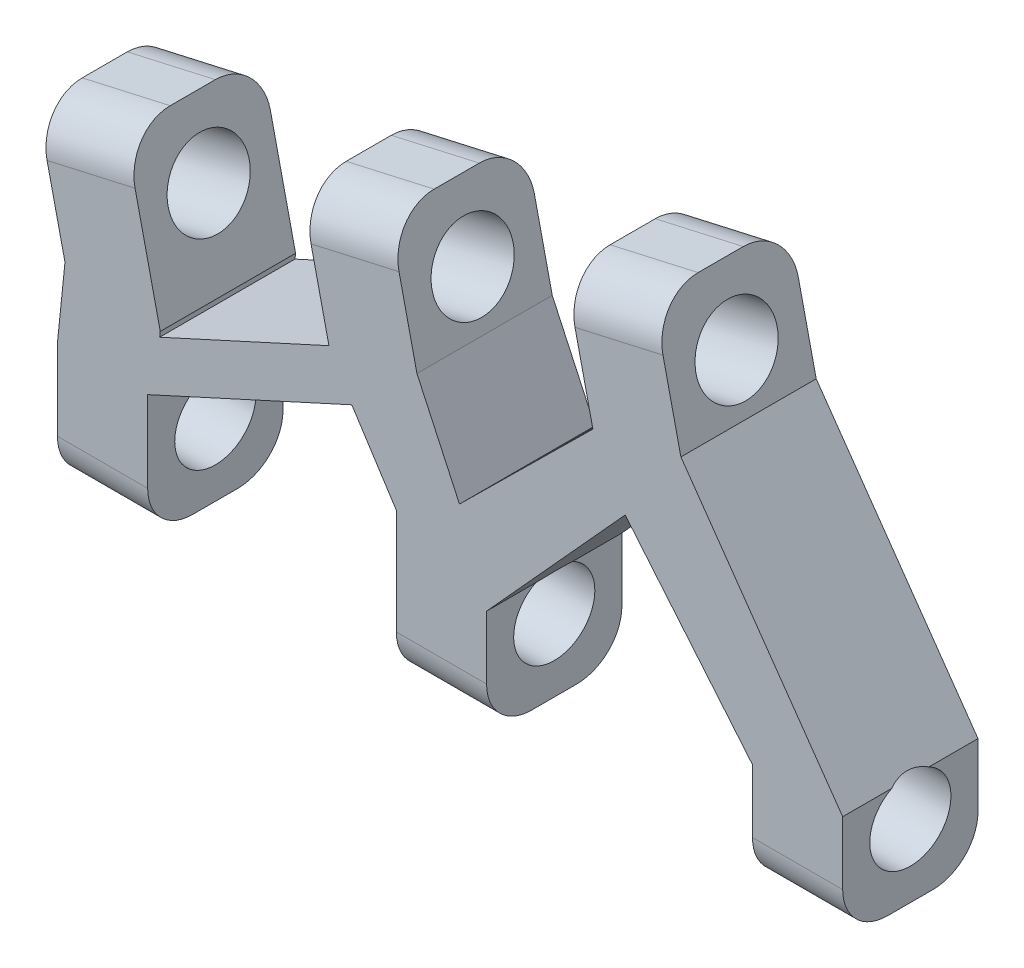
from build123d import *

# Parameters (mm, degrees)
BOSS_EXTRUDE1_DEPTH = 15
SKETCH3_R           = 4.5
CUT_EXTRUDE1_DEPTH  = 110.607127014
SKETCH4_R           = 4.5
CUT_EXTRUDE2_DEPTH  = 95.229658783


with BuildPart() as part:
    # Sketch2 → Boss-Extrude1 (new body)
    with BuildSketch(Plane.XY):
        Polygon((-216.019091895, 17.382825188), (-212.930081555, 3.727862166), (-213.764027452, -4.398444723), (-213.764027452, -18.398444723), (-203.764027452, -18.398444723), (-203.764027452, -4.398444723), (-181.136073294, 5.936039038), (-176.194518086, -1.729112182), (-176.194518086, -18.398444723), (-166.194518086, -18.398444723), (-166.194518086, -6.398444723), (-150.828445352, 10.518587471), (-136.720595227, -6.398444723), (-136.720595227, -18.398444723), (-126.720595227, -18.398444723), (-126.720595227, -6.398444723), (-144.655266447, 19.172913865), (-147.744276787, 32.827876887), (-157.497821802, 30.62144093), (-154.408811463, 16.966477908), (-169.201460721, 2.373183741), (-173.915901493, 12.553605994), (-177.004911833, 26.208569016), (-186.758456849, 24.002133059), (-183.669446509, 10.347170037), (-202.433997642, 1.777153163), (-202.369507285, 2.366827181), (-206.265546879, 19.589261145), align=None)
    extrude(amount=BOSS_EXTRUDE1_DEPTH)

    # Sketch3 → Cut-Extrude1 (cut, through all)
    with BuildSketch(Plane(origin=(-201.761622141, -45.642286691, 0), x_dir=(0, 0, 1), z_dir=(-0.9753545015403321, -0.22064359570359257, 0))):
        with Locations(Location((7.5, 56.617645973, 0), (0, 0, 270))):
            Circle(SKETCH3_R)
        with BuildLine():
            Line((15, 59.617645973), (20.879218682, 59.617645973))
            Line((20.879218682, 59.617645973), (20.879218682, 67.791125086))
            Line((20.879218682, 67.791125086), (14.372574649, 67.791125086))
            Line((14.372574649, 67.791125086), (-2.562016451, 67.791125086))
            Line((-2.562016451, 67.791125086), (-2.562016451, 59.617645973))
            Line((-2.562016451, 59.617645973), (0, 59.617645973))
            ThreePointArc((0, 59.617645973), (1.464466094, 63.153179879), (5, 64.617645973))
            Line((5, 64.617645973), (8.859819986, 64.617645973))
            Line((8.859819986, 64.617645973), (10, 64.617645973))
            ThreePointArc((10, 64.617645973), (13.535533906, 63.153179879), (15, 59.617645973))
        make_face()
    extrude(amount=-CUT_EXTRUDE1_DEPTH, mode=Mode.SUBTRACT)

    # Sketch4 → Cut-Extrude2 (cut, through all)
    with BuildSketch(Plane.ZY.offset(213.764027452)):
        with Locations(Location((7.5, -10.398444723, 0), (0, 0, 62.733955549))):
            Circle(SKETCH4_R)
        with BuildLine():
            Line((5, -18.398444723), (10, -18.398444723))
            ThreePointArc((10, -18.398444723), (13.535533906, -16.933978629), (15, -13.398444723))
            Line((15, -13.398444723), (20.19317818, -13.398444723))
            Line((20.19317818, -13.398444723), (20.19317818, -22.025318281))
            Line((20.19317818, -22.025318281), (-2.656583896, -22.025318281))
            Line((-2.656583896, -22.025318281), (-2.656583896, -13.398444723))
            Line((-2.656583896, -13.398444723), (0, -13.398444723))
            ThreePointArc((0, -13.398444723), (1.464466094, -16.933978629), (5, -18.398444723))
        make_face()
    extrude(amount=-CUT_EXTRUDE2_DEPTH, mode=Mode.SUBTRACT)


solid = part.part
